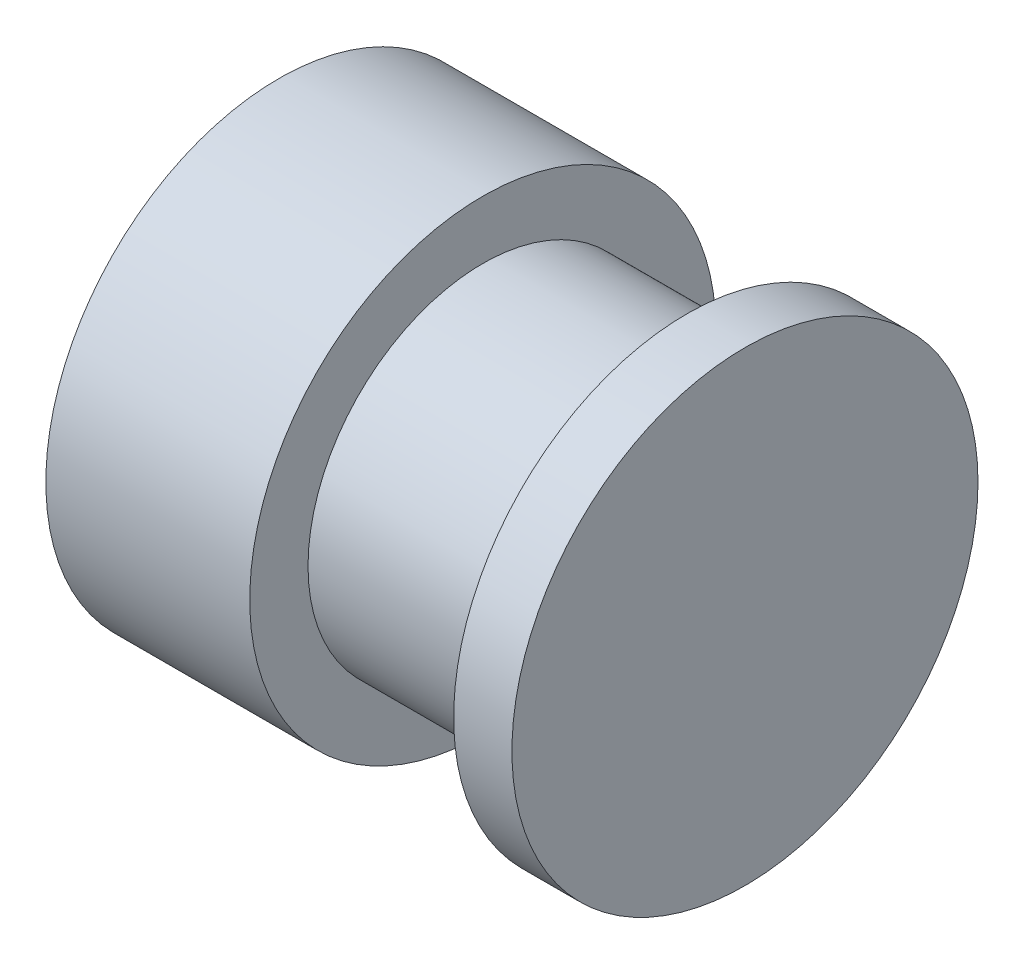
from build123d import *


with BuildPart() as part:
    # Sketch1 → Revolve1 (revolve)
    with BuildSketch(Plane.XY, mode=Mode.PRIVATE) as revolve1_sk:
        Polygon((0, 0), (0, 8), (7, 8), (7, 6), (14, 6), (14, 8), (16, 8), (16, 0), align=None)
    revolve(revolve1_sk.sketch.rotate(Axis((16, 0, 0), (-1, 0, 0)), 90), axis=Axis((16, 0, 0), (-1, 0, 0)))


solid = part.part
